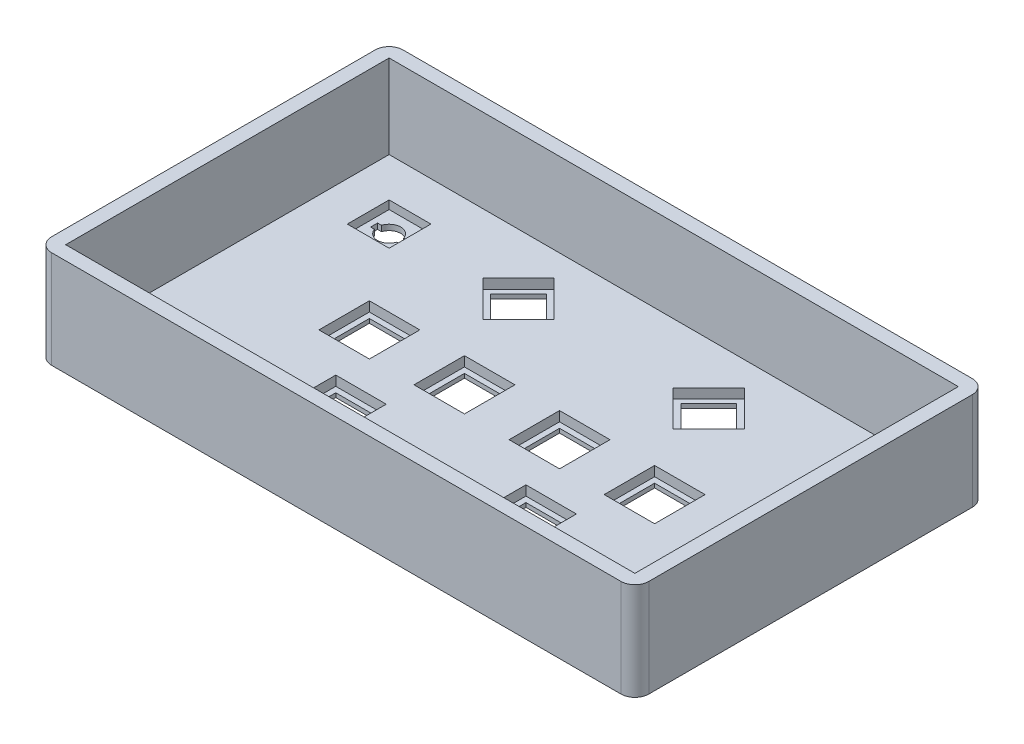
from build123d import *

# Parameters (mm, degrees)
SKETCH1_W           = 14.1
SKETCH1_H           = 14.1
BOSS_EXTRUDE1_DEPTH = 5
BOSS_EXTRUDE2_START = 30
SKETCH1_3_W         = 204.140411229
SKETCH1_3_H         = 116
SKETCH1_3_W_2       = 14.1
SKETCH1_3_H_2       = 14.1
SKETCH1_3_R         = 4.175
SKETCH1_3_W_3       = 10.8
SKETCH1_3_H_3       = 2.5
BOSS_EXTRUDE2_DEPTH = 30
SKETCH3_W           = 18.1
SKETCH3_H           = 18.1
CUT_EXTRUDE1_DEPTH  = 3.5
SKETCH4_W           = 15
SKETCH4_H           = 15
CUT_EXTRUDE2_DEPTH  = 3


with BuildPart() as part:
    # Sketch1 → Boss-Extrude1 (new body)
    with BuildSketch(Plane(origin=(0, 0, 0), x_dir=(1, 0, 0), z_dir=(0, 1, 0))):
        with BuildLine():
            Line((-5, 116), (-5, 0))
            ThreePointArc((-5, 0), (-3.535533906, -3.535533906), (0, -5))
            Line((0, -5), (204.140411229, -5))
            ThreePointArc((204.140411229, -5), (207.675945135, -3.535533906), (209.140411229, 0))
            Line((209.140411229, 0), (209.140411229, 116))
            ThreePointArc((209.140411229, 116), (207.675945135, 119.535533906), (204.140411229, 121))
            Line((204.140411229, 121), (0, 121))
            ThreePointArc((0, 121), (-3.535533906, 119.535533906), (-5, 116))
        make_face()
        with Locations((50.920205615, 58)):
            Rectangle(SKETCH1_W, SKETCH1_H, mode=Mode.SUBTRACT)
        with Locations((85.020205615, 58)):
            Rectangle(SKETCH1_W, SKETCH1_H, mode=Mode.SUBTRACT)
        with Locations((67.970205615, 28.9)):
            Rectangle(SKETCH1_W, SKETCH1_H, mode=Mode.SUBTRACT)
        with Locations((136.170205615, 28.9)):
            Rectangle(SKETCH1_W, SKETCH1_H, mode=Mode.SUBTRACT)
        with Locations((119.120205615, 58)):
            Rectangle(SKETCH1_W, SKETCH1_H, mode=Mode.SUBTRACT)
        with Locations((153.220205615, 58)):
            Rectangle(SKETCH1_W, SKETCH1_H, mode=Mode.SUBTRACT)
        Polygon((77.940411229, 94.414213562), (67.970205615, 84.444007948), (58, 94.414213562), (67.970205615, 104.384419177), align=None, mode=Mode.SUBTRACT)
        Polygon((126.2, 94.414213562), (136.170205615, 104.384419177), (146.140411229, 94.414213562), (136.170205615, 84.444007948), align=None, mode=Mode.SUBTRACT)
        with BuildLine():
            Line((16.185786438, 93.164213562), (16.185786438, 95.664213562))
            Line((16.185786438, 95.664213562), (17.60230492, 95.664213562))
            ThreePointArc((17.60230492, 95.664213562), (21.585786438, 98.589213562), (25.569267955, 95.664213562))
            Line((25.569267955, 95.664213562), (26.985786438, 95.664213562))
            Line((26.985786438, 95.664213562), (26.985786438, 93.164213562))
            Line((26.985786438, 93.164213562), (25.569267955, 93.164213562))
            ThreePointArc((25.569267955, 93.164213562), (21.585786438, 90.239213562), (17.60230492, 93.164213562))
            Line((17.60230492, 93.164213562), (16.185786438, 93.164213562))
        make_face(mode=Mode.SUBTRACT)
        with BuildLine():
            Line((177.154624792, 93.164213562), (177.154624792, 95.664213562))
            Line((177.154624792, 95.664213562), (178.571143274, 95.664213562))
            ThreePointArc((178.571143274, 95.664213562), (182.554624792, 98.589213562), (186.538106309, 95.664213562))
            Line((186.538106309, 95.664213562), (187.954624792, 95.664213562))
            Line((187.954624792, 95.664213562), (187.954624792, 93.164213562))
            Line((187.954624792, 93.164213562), (186.538106309, 93.164213562))
            ThreePointArc((186.538106309, 93.164213562), (182.554624792, 90.239213562), (178.571143274, 93.164213562))
            Line((178.571143274, 93.164213562), (177.154624792, 93.164213562))
        make_face(mode=Mode.SUBTRACT)
    extrude(amount=-BOSS_EXTRUDE1_DEPTH)

    # Sketch1<3> → Boss-Extrude2 (add)
    # profile 1 of 13: a face of its own
    with BuildSketch(Plane(origin=(0, 0, 0), x_dir=(1, 0, 0), z_dir=(0, 1, 0)).offset(BOSS_EXTRUDE2_START)):
        with BuildLine():
            Line((-5, 0), (-5, 116))
            ThreePointArc((-5, 116), (-3.535533906, 119.535533906), (0, 121))
            Line((0, 121), (204.140411229, 121))
            ThreePointArc((204.140411229, 121), (207.675945135, 119.535533906), (209.140411229, 116))
            Line((209.140411229, 116), (209.140411229, 0))
            ThreePointArc((209.140411229, 0), (207.675945135, -3.535533906), (204.140411229, -5))
            Line((204.140411229, -5), (0, -5))
            ThreePointArc((0, -5), (-3.535533906, -3.535533906), (-5, 0))
        make_face()
        with Locations((102.070205615, 58)):
            Rectangle(SKETCH1_3_W, SKETCH1_3_H, mode=Mode.SUBTRACT)
    # profile 2 of 13: a face of its own
    with BuildSketch(Plane(origin=(0, 0, 0), x_dir=(1, 0, 0), z_dir=(0, 1, 0)).offset(BOSS_EXTRUDE2_START)):
        Polygon((136.170205615, 84.444007948), (126.2, 94.414213562), (136.170205615, 104.384419177), (146.140411229, 94.414213562), align=None)
    # profile 3 of 13: a face of its own
    with BuildSketch(Plane(origin=(0, 0, 0), x_dir=(1, 0, 0), z_dir=(0, 1, 0)).offset(BOSS_EXTRUDE2_START)):
        Polygon((67.970205615, 104.384419177), (58, 94.414213562), (67.970205615, 84.444007948), (77.940411229, 94.414213562), align=None)
    # profile 4 of 13: a face of its own
    with BuildSketch(Plane(origin=(0, 0, 0), x_dir=(1, 0, 0), z_dir=(0, 1, 0)).offset(BOSS_EXTRUDE2_START)):
        with Locations((153.220205615, 58)):
            Rectangle(SKETCH1_3_W_2, SKETCH1_3_H_2)
    # profile 5 of 13: a face of its own
    with BuildSketch(Plane(origin=(0, 0, 0), x_dir=(1, 0, 0), z_dir=(0, 1, 0)).offset(BOSS_EXTRUDE2_START)):
        with Locations((119.120205615, 58)):
            Rectangle(SKETCH1_3_W_2, SKETCH1_3_H_2)
    # profile 6 of 13: a face of its own
    with BuildSketch(Plane(origin=(0, 0, 0), x_dir=(1, 0, 0), z_dir=(0, 1, 0)).offset(BOSS_EXTRUDE2_START)):
        with Locations((136.170205615, 28.9)):
            Rectangle(SKETCH1_3_W_2, SKETCH1_3_H_2)
    # profile 7 of 13: a face of its own
    with BuildSketch(Plane(origin=(0, 0, 0), x_dir=(1, 0, 0), z_dir=(0, 1, 0)).offset(BOSS_EXTRUDE2_START)):
        with Locations((67.970205615, 28.9)):
            Rectangle(SKETCH1_3_W_2, SKETCH1_3_H_2)
    # profile 8 of 13: a face of its own
    with BuildSketch(Plane(origin=(0, 0, 0), x_dir=(1, 0, 0), z_dir=(0, 1, 0)).offset(BOSS_EXTRUDE2_START)):
        with Locations((85.020205615, 58)):
            Rectangle(SKETCH1_3_W_2, SKETCH1_3_H_2)
    # profile 9 of 13: a face of its own
    with BuildSketch(Plane(origin=(0, 0, 0), x_dir=(1, 0, 0), z_dir=(0, 1, 0)).offset(BOSS_EXTRUDE2_START)):
        with Locations((50.920205615, 58)):
            Rectangle(SKETCH1_3_W_2, SKETCH1_3_H_2)
    # profile 10 of 13: a face of its own
    with BuildSketch(Plane(origin=(0, 0, 0), x_dir=(1, 0, 0), z_dir=(0, 1, 0)).offset(BOSS_EXTRUDE2_START)):
        with Locations((182.554624792, 94.414213562)):
            Circle(SKETCH1_3_R)
    # profile 11 of 13: a face of its own
    with BuildSketch(Plane(origin=(0, 0, 0), x_dir=(1, 0, 0), z_dir=(0, 1, 0)).offset(BOSS_EXTRUDE2_START)):
        with Locations((21.585786438, 94.414213562)):
            Circle(SKETCH1_3_R)
    # profile 12 of 13: a face of its own
    with BuildSketch(Plane(origin=(0, 0, 0), x_dir=(1, 0, 0), z_dir=(0, 1, 0)).offset(BOSS_EXTRUDE2_START)):
        with Locations((21.585786438, 94.414213562)):
            Rectangle(SKETCH1_3_W_3, SKETCH1_3_H_3)
    # profile 13 of 13: a face of its own
    with BuildSketch(Plane(origin=(0, 0, 0), x_dir=(1, 0, 0), z_dir=(0, 1, 0)).offset(BOSS_EXTRUDE2_START)):
        with Locations((182.554624792, 94.414213562)):
            Rectangle(SKETCH1_3_W_3, SKETCH1_3_H_3)
    extrude(amount=-BOSS_EXTRUDE2_DEPTH)


with BuildPart() as boss_extrude2_kept_piece:
    # of the separate pieces the step leaves, the one the design keeps (boss_extrude2_pieces_kept)
    add(part.part.solids().sort_by_distance((204.140411229, -5, -121))[0])

    # Sketch3 → Cut-Extrude1 (cut)
    with BuildSketch(Plane(origin=(0, 0, 0), x_dir=(1, 0, 0), z_dir=(0, 1, 0))):
        with Locations((50.920205615, 58)):
            Rectangle(SKETCH3_W, SKETCH3_H)
        Polygon((67.970205615, 107.212846302), (55.171572875, 94.414213562), (67.970205615, 81.615580823), (80.768838354, 94.414213562), align=None)
        with Locations((67.970205615, 28.9)):
            Rectangle(SKETCH3_W, SKETCH3_H)
        with Locations((85.020205615, 58)):
            Rectangle(SKETCH3_W, SKETCH3_H)
        with Locations((119.120205615, 58)):
            Rectangle(SKETCH3_W, SKETCH3_H)
        with Locations((153.220205615, 58)):
            Rectangle(SKETCH3_W, SKETCH3_H)
        Polygon((123.371572875, 94.414213562), (136.170205615, 81.615580823), (148.968838354, 94.414213562), (136.170205615, 107.212846302), align=None)
        with Locations((136.170205615, 28.9)):
            Rectangle(SKETCH3_W, SKETCH3_H)
    extrude(amount=-CUT_EXTRUDE1_DEPTH, mode=Mode.SUBTRACT)

    # Sketch4 → Cut-Extrude2 (cut)
    with BuildSketch(Plane(origin=(0, 0, 0), x_dir=(1, 0, 0), z_dir=(0, 1, 0))):
        with Locations((21.585786438, 94.414213562)):
            Rectangle(SKETCH4_W, SKETCH4_H)
        with Locations((182.554624792, 94.414213562)):
            Rectangle(SKETCH4_W, SKETCH4_H)
    extrude(amount=-CUT_EXTRUDE2_DEPTH, mode=Mode.SUBTRACT)


solid = boss_extrude2_kept_piece.part
